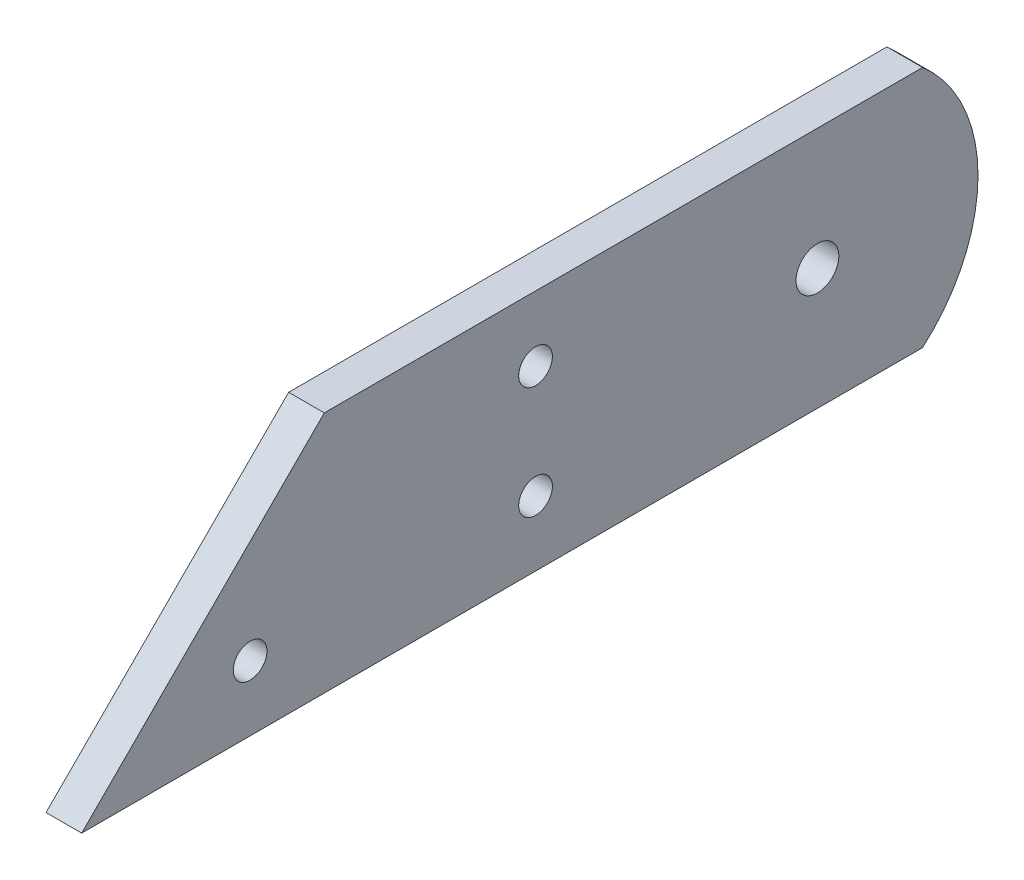
from build123d import *

# Parameters (mm, degrees)
BOSS_EXTRUDE1_DEPTH = 6.35
BOSS_EXTRUDE2_DEPTH = 6.35
CUT_EXTRUDE1_DEPTH  = 176.195383741
SKETCH4_R           = 3
CUT_EXTRUDE2_DEPTH  = 169.439588188
CUT_EXTRUDE3_DEPTH  = 6.35
SKETCH7_R           = 3.81
BOSS_EXTRUDE3_DEPTH = 6.35


with BuildPart() as part:
    # Sketch1 → Boss-Extrude1 (new body)
    with BuildSketch(Plane(origin=(0, 0, 0), x_dir=(0, 0, -1), z_dir=(1, 0, 0))):
        with BuildLine():
            Line((-106.172, 0), (-62.992, 43.18))
            Line((-62.992, 43.18), (0, 43.18))
            Line((0, 43.18), (0, 40.64))
            ThreePointArc((0, 40.64), (-6.479930943, 21.59), (0, 2.54))
            Line((0, 2.54), (0, 0))
            Line((0, 0), (-106.172, 0))
        make_face()
    extrude(amount=BOSS_EXTRUDE1_DEPTH)

    # Sketch2 → Boss-Extrude2 (add)
    with BuildSketch(Plane(origin=(6.35, 0, 0), x_dir=(0, 0, -1), z_dir=(1, 0, 0))):
        Polygon((-68.072, 0), (-169.672, 0), (-144.272, 10.16), (-68.072, 17.78), align=None)
    extrude(amount=-BOSS_EXTRUDE2_DEPTH)

    # Sketch3 → Cut-Extrude1 (cut, through all)
    with BuildSketch(Plane(origin=(6.35, 0, 0), x_dir=(0, 0, -1), z_dir=(1, 0, 0))):
        Polygon((-106.172, 0), (-162.687, 2.794), (-169.672, 0), align=None)
    extrude(amount=-CUT_EXTRUDE1_DEPTH, mode=Mode.SUBTRACT)

    # Sketch4 → Cut-Extrude2 (cut, through all)
    with BuildSketch(Plane(origin=(6.35, 0, 0), x_dir=(0, 0, -1), z_dir=(1, 0, 0))):
        with Locations((-25.4, 31.59)):
            Circle(SKETCH4_R)
        with Locations((-25.4, 11.59)):
            Circle(SKETCH4_R)
        with Locations((-76.2, 11.59)):
            Circle(SKETCH4_R)
    extrude(amount=-CUT_EXTRUDE2_DEPTH, mode=Mode.SUBTRACT)

    # Sketch6 → Cut-Extrude3 (cut)
    with BuildSketch(Plane.ZY):
        Polygon((62.992, 43.18), (90.649777778, 15.522222222), (108.309937594, -2.137937594), (165.318856779, -0.913782118), (157.233600138, 13.290047118), (95.237394621, 20.109839066), align=None)
    extrude(amount=-CUT_EXTRUDE3_DEPTH, mode=Mode.SUBTRACT)

    # Sketch7 → Boss-Extrude3 (add)
    with BuildSketch(Plane.ZY):
        with BuildLine():
            Line((0, 43.18), (-43.481110833, 43.18))
            ThreePointArc((-43.481110833, 43.18), (-53.337069057, 21.59), (-43.481110833, 0))
            Line((-43.481110833, 0), (0, 0))
            Line((0, 0), (0, 2.54))
            ThreePointArc((0, 2.54), (6.479930943, 21.59), (0, 40.64))
            Line((0, 40.64), (0, 43.18))
        make_face()
        with Locations((-24.762069057, 21.59)):
            Circle(SKETCH7_R, mode=Mode.SUBTRACT)
    extrude(amount=-BOSS_EXTRUDE3_DEPTH)


solid = part.part
